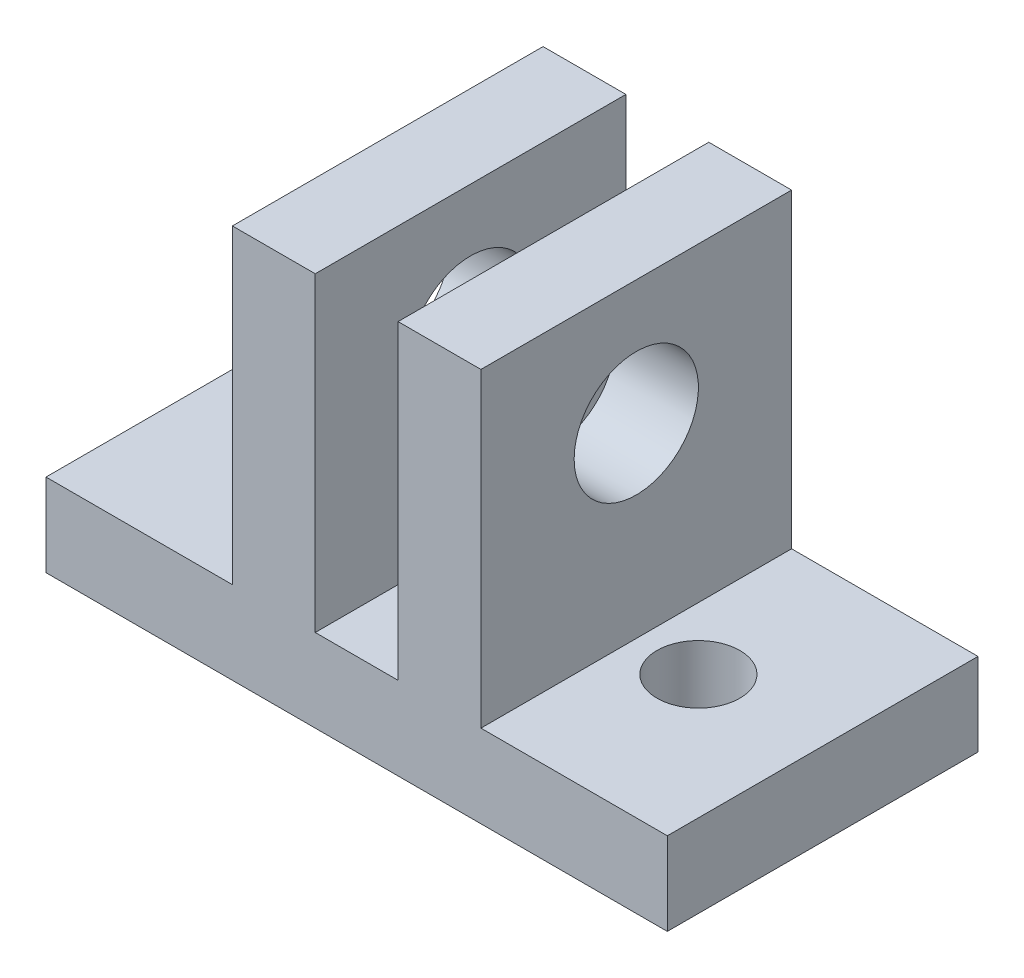
from build123d import *

# Parameters (mm, degrees)
SKETCH_1_W          = 30
SKETCH_1_H          = 15
EXTRUDE_1_DEPTH     = 4
SKETCH_2_W          = 4
SKETCH_2_H          = 15
EXTRUDE_2_DEPTH     = 15
SKETCH_3_R          = 2
CUT_EXTRUDE_1_DEPTH = 15
SKETCH_4_R          = 3
CUT_EXTRUDE_2_DEPTH = 15


with BuildPart() as part:
    # Эскиз1 → Бобышка-Вытянуть1 (new body)
    with BuildSketch(Plane(origin=(0, 0, 0), x_dir=(1, 0, 0), z_dir=(0, 1, 0))):
        with Locations((15, 7.5)):
            Rectangle(SKETCH_1_W, SKETCH_1_H)
    extrude(amount=EXTRUDE_1_DEPTH)

    # Эскиз2 → Бобышка-Вытянуть2 (add)
    with BuildSketch(Plane(origin=(0, 4, 0), x_dir=(1, 0, 0), z_dir=(0, 1, 0))):
        with Locations((11, 7.5)):
            Rectangle(SKETCH_2_W, SKETCH_2_H)
        with Locations((19, 7.5)):
            Rectangle(SKETCH_2_W, SKETCH_2_H)
    extrude(amount=EXTRUDE_2_DEPTH)

    # Эскиз3 → Вырез-Вытянуть1 (cut)
    with BuildSketch(Plane.XZ):
        with Locations(Location((6, -7.5, 0), (0, 0, 270))):
            Circle(SKETCH_3_R)
        with Locations(Location((24, -7.5, 0), (0, 0, 270))):
            Circle(SKETCH_3_R)
    extrude(amount=-CUT_EXTRUDE_1_DEPTH, mode=Mode.SUBTRACT)

    # Эскиз4 → Вырез-Вытянуть2 (cut)
    with BuildSketch(Plane.ZY.offset(-9)):
        with Locations((-7.5, 13)):
            Circle(SKETCH_4_R)
    extrude(amount=-CUT_EXTRUDE_2_DEPTH, mode=Mode.SUBTRACT)


solid = part.part
